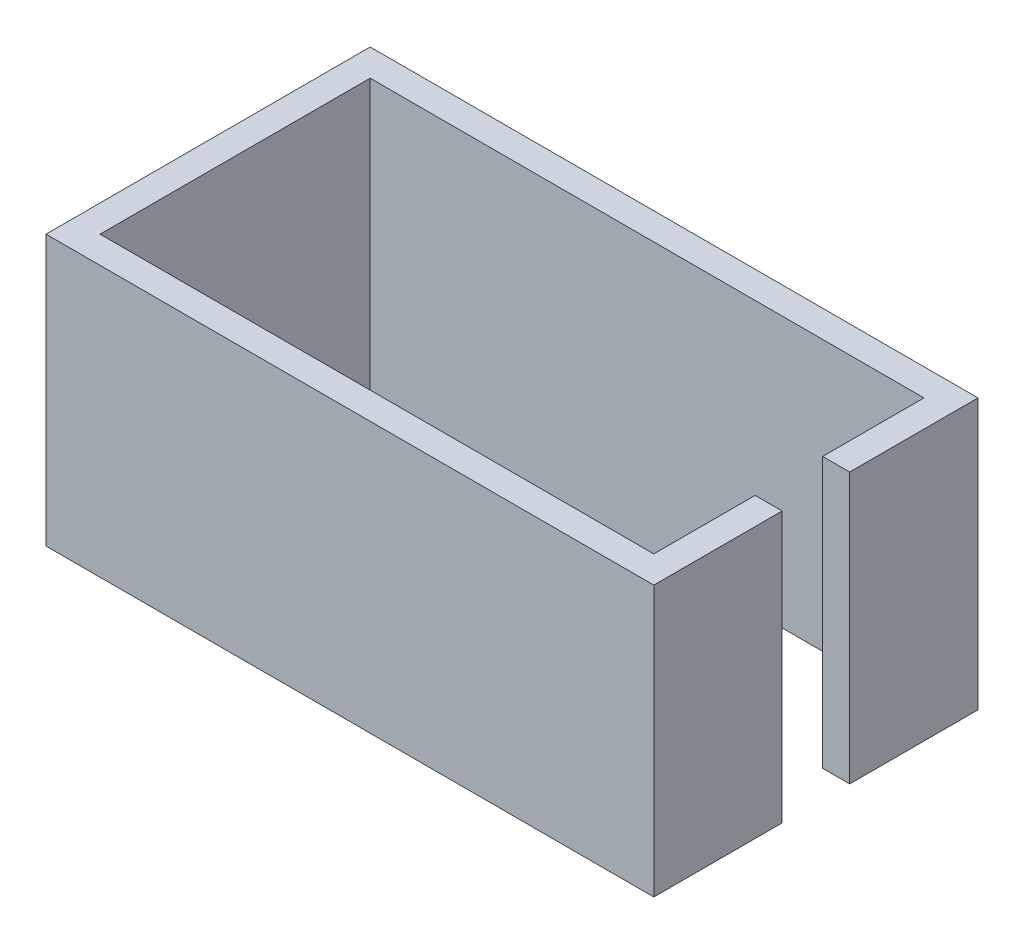
from build123d import *

# Parameters (mm, degrees)
SKETCH_1_W          = 22.5
SKETCH_1_H          = 12
SKETCH_1_W_2        = 20.5
SKETCH_1_H_2        = 10
EXTRUDE_1_DEPTH     = 10
SKETCH_2_W          = 2.5
SKETCH_2_H          = 10
CUT_EXTRUDE_1_DEPTH = 5


with BuildPart() as part:
    # 草图1 → 凸台-拉伸1 (new body)
    with BuildSketch(Plane(origin=(0, 0, 0), x_dir=(1, 0, 0), z_dir=(0, 1, 0))):
        Rectangle(SKETCH_1_W, SKETCH_1_H)
        Rectangle(SKETCH_1_W_2, SKETCH_1_H_2, mode=Mode.SUBTRACT)
    extrude(amount=EXTRUDE_1_DEPTH)

    # 草图2 → 切除-拉伸1 (cut)
    with BuildSketch(Plane(origin=(11.25, 0, 0), x_dir=(0, 0, -1), z_dir=(1, 0, 0))):
        with Locations((0, 5)):
            Rectangle(SKETCH_2_W, SKETCH_2_H)
    extrude(amount=-CUT_EXTRUDE_1_DEPTH, mode=Mode.SUBTRACT)


solid = part.part
